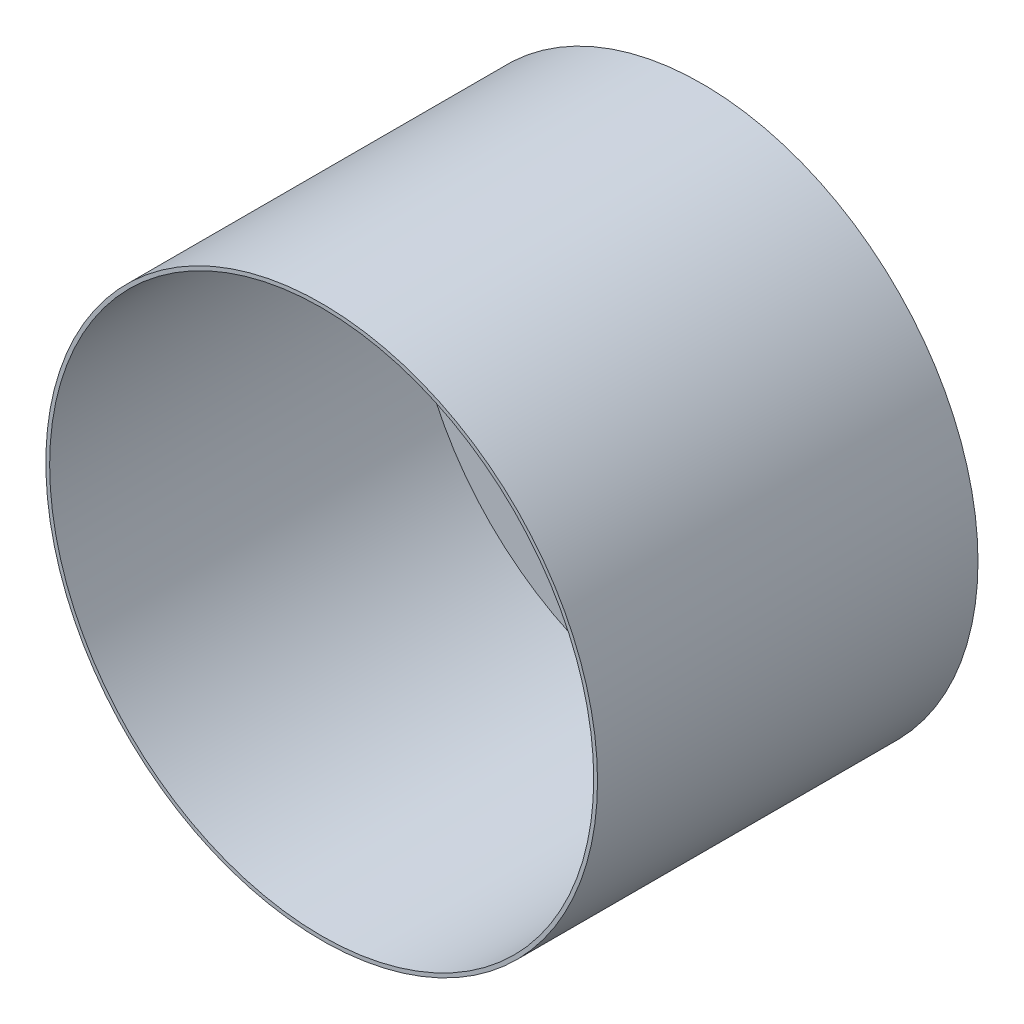
from build123d import *

# Parameters (mm, degrees)
SKETCH1_R           = 7.25
BOSS_EXTRUDE1_DEPTH = 10
SKETCH2_R           = 7.15
CUT_EXTRUDE1_DEPTH  = 9.5


with BuildPart() as part:
    # Sketch1 → Boss-Extrude1 (new body)
    with BuildSketch(Plane.XY):
        Circle(SKETCH1_R)
    extrude(amount=BOSS_EXTRUDE1_DEPTH)

    # Sketch2 → Cut-Extrude1 (cut)
    with BuildSketch(Plane.XY.offset(10)):
        Circle(SKETCH2_R)
    extrude(amount=-CUT_EXTRUDE1_DEPTH, mode=Mode.SUBTRACT)


solid = part.part
